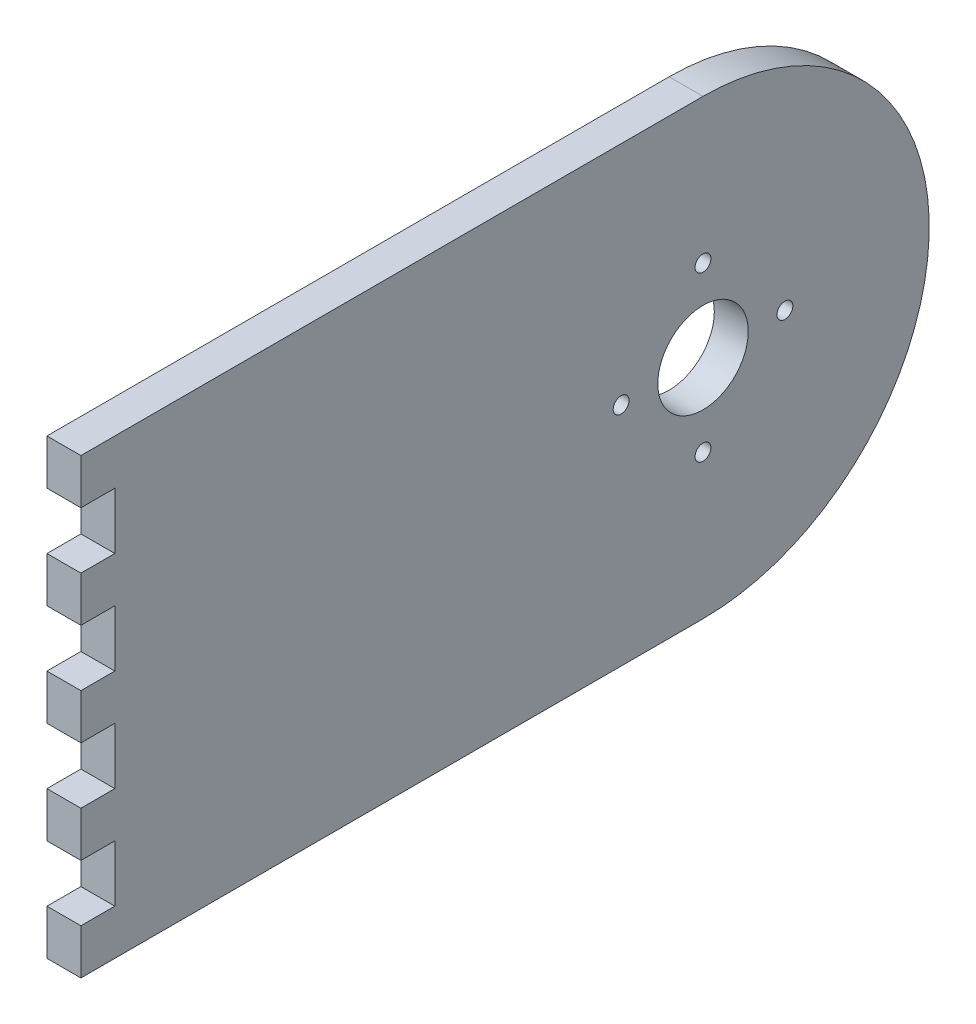
from build123d import *

# Parameters (mm, degrees)
SKETCH1_R           = 4
SKETCH1_R_2         = 0.7
BOSS_EXTRUDE1_DEPTH = 3


with BuildPart() as part:
    # Sketch1 → Boss-Extrude1 (new body)
    with BuildSketch(Plane(origin=(0, 0, 0), x_dir=(0, 0, -1), z_dir=(1, 0, 0))):
        with BuildLine():
            Line((0, 20), (-55, 20))
            Line((-55, 20), (-55, 16))
            Line((-55, 16), (-52, 16))
            Line((-52, 16), (-52, 11))
            Line((-52, 11), (-55, 11))
            Line((-55, 11), (-55, 7))
            Line((-55, 7), (-52, 7))
            Line((-52, 7), (-52, 2))
            Line((-52, 2), (-55, 2))
            Line((-55, 2), (-55, -2))
            Line((-55, -2), (-52, -2))
            Line((-52, -2), (-52, -7))
            Line((-52, -7), (-55, -7))
            Line((-55, -7), (-55, -11))
            Line((-55, -11), (-52, -11))
            Line((-52, -11), (-52, -16))
            Line((-52, -16), (-55, -16))
            Line((-55, -16), (-55, -20))
            Line((-55, -20), (0, -20))
            ThreePointArc((0, -20), (20, 0), (0, 20))
        make_face()
        Circle(SKETCH1_R, mode=Mode.SUBTRACT)
        with Locations((-7.24, 0)):
            Circle(SKETCH1_R_2, mode=Mode.SUBTRACT)
        with Locations((0, 7.24)):
            Circle(SKETCH1_R_2, mode=Mode.SUBTRACT)
        with Locations((7.24, 0)):
            Circle(SKETCH1_R_2, mode=Mode.SUBTRACT)
        with Locations((0, -7.24)):
            Circle(SKETCH1_R_2, mode=Mode.SUBTRACT)
    extrude(amount=BOSS_EXTRUDE1_DEPTH)


solid = part.part
